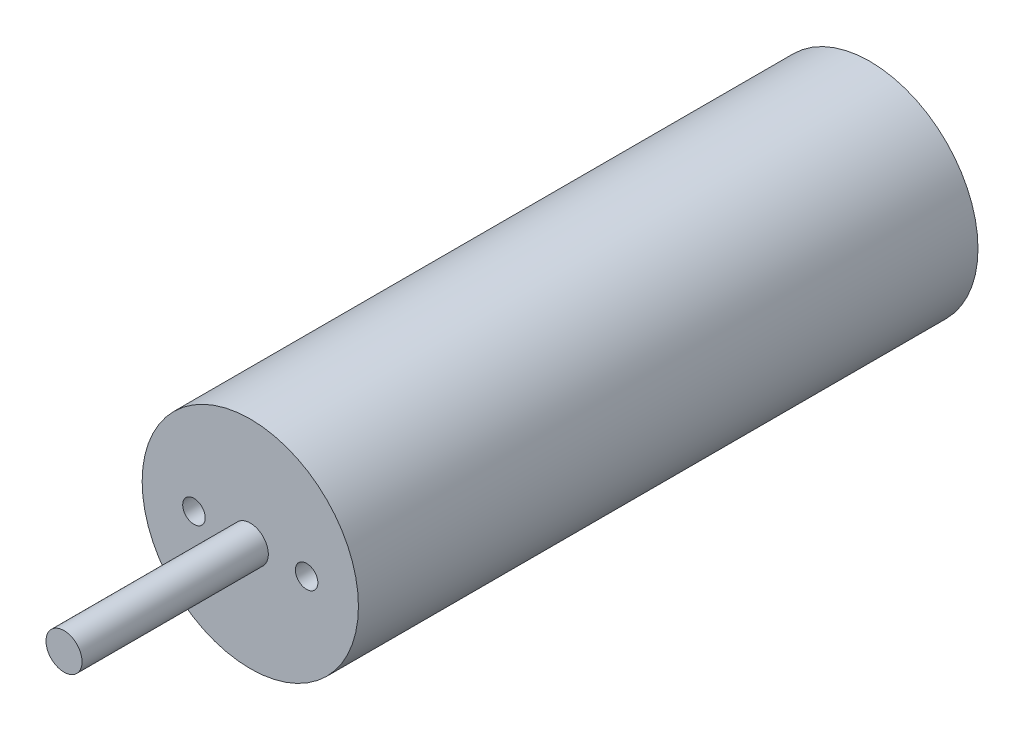
from build123d import *

# Parameters (mm, degrees)
SKETCH1_R           = 12.192
BOSS_EXTRUDE1_DEPTH = 69.85
SKETCH2_R           = 2.032
BOSS_EXTRUDE2_DEPTH = 21
SKETCH3_R           = 1.27
CUT_EXTRUDE1_DEPTH  = 11.43


with BuildPart() as part:
    # Sketch1 → Boss-Extrude1 (new body)
    with BuildSketch(Plane.XY):
        Circle(SKETCH1_R)
    extrude(amount=BOSS_EXTRUDE1_DEPTH)

    # Sketch2 → Boss-Extrude2 (add)
    with BuildSketch(Plane.XY.offset(69.85)):
        with Locations(Location((0, 0, 0), (0, 0, 180))):
            Circle(SKETCH2_R)
    extrude(amount=BOSS_EXTRUDE2_DEPTH)

    # Sketch3 → Cut-Extrude1 (cut)
    with BuildSketch(Plane.XY.offset(69.85)):
        with Locations((6.35, 0)):
            Circle(SKETCH3_R)
        with Locations((-6.35, 0)):
            Circle(SKETCH3_R)
    extrude(amount=-CUT_EXTRUDE1_DEPTH, mode=Mode.SUBTRACT)


solid = part.part
